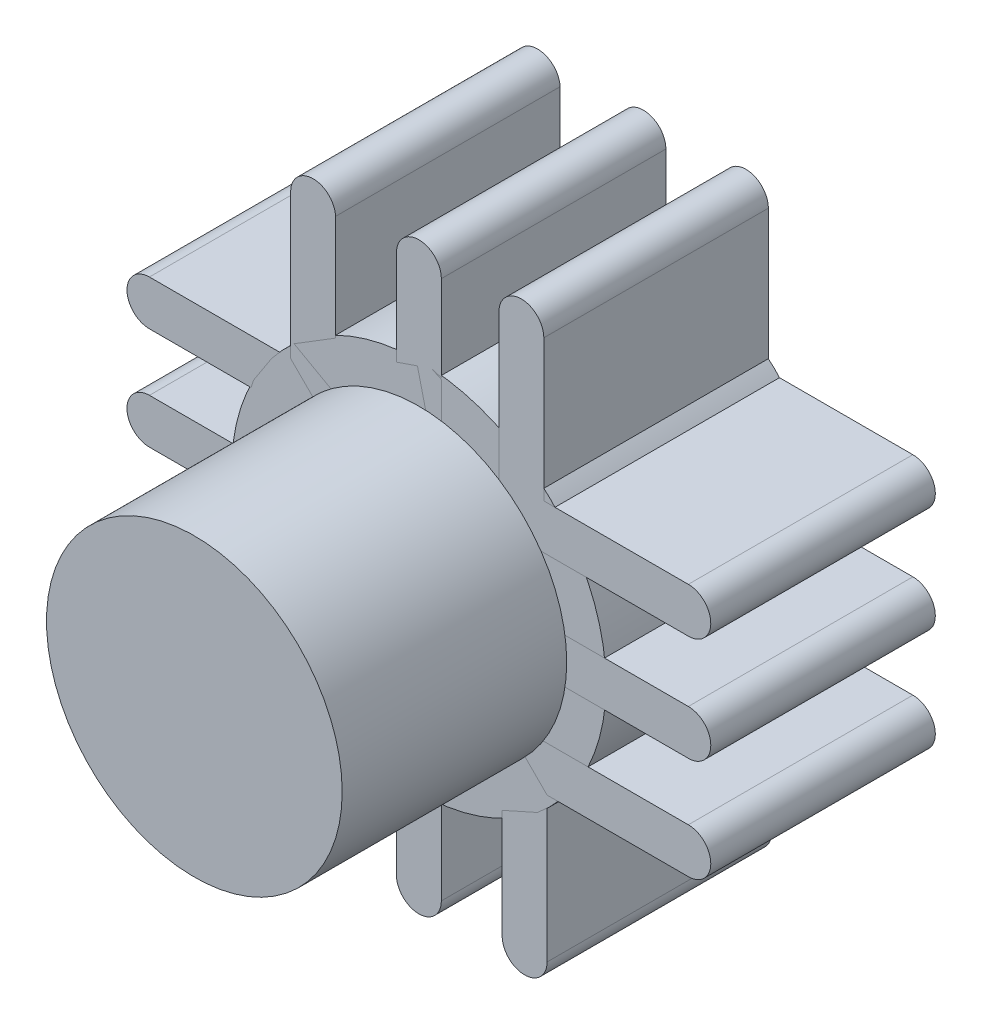
from build123d import *

# Parameters (mm, degrees)
BOSS_EXTRUDE1_DEPTH   = 10
BOSS_EXTRUDE1_2_DEPTH = 10
BOSS_EXTRUDE1_3_DEPTH = 10
BOSS_EXTRUDE1_4_DEPTH = 10
BOSS_EXTRUDE1_5_DEPTH = 10
BOSS_EXTRUDE1_6_DEPTH = 10
BOSS_EXTRUDE1_7_DEPTH = 10
BOSS_EXTRUDE1_8_DEPTH = 10
SKETCH2_R             = 8.334375
BOSS_EXTRUDE2_DEPTH   = 10
SKETCH3_R             = 6.584375
BOSS_EXTRUDE3_DEPTH   = 20


with BuildPart() as part:
    # Sketch1 → Boss-Extrude1 (new body)
    with BuildSketch(Plane.XY):
        with BuildLine():
            Line((-1, 3.665680024), (-1, 12))
            ThreePointArc((-1, 12), (0, 13), (1, 12))
            Line((1, 12), (1, 3.665680024))
            ThreePointArc((1, 3.665680024), (0, 2.665680024), (-1, 3.665680024))
        make_face()
    extrude(amount=BOSS_EXTRUDE1_DEPTH)


with BuildPart() as body_2:
    # Sketch1 → Boss-Extrude1 2 (new body)
    with BuildSketch(Plane.XY):
        with BuildLine():
            Line((5.5637058, 11.999998584), (5.5637058, 5.710489197))
            Line((5.5637058, 5.710489197), (11.999393728, 5.710489197))
            ThreePointArc((11.999393728, 5.710489197), (12.999696818, 4.734512976), (12.048638904, 3.710489197))
            Line((12.048638904, 3.710489197), (3.563457884, 3.710489197))
            Line((3.563457884, 3.710489197), (3.563457884, 11.999876038))
            ThreePointArc((3.563457884, 11.999876038), (4.563520572, 12.999999998), (5.5637058, 11.999998584))
        make_face()
    extrude(amount=BOSS_EXTRUDE1_2_DEPTH)


with BuildPart() as body_3:
    # Sketch1 → Boss-Extrude1 3 (new body)
    with BuildSketch(Plane.XY):
        with BuildLine():
            Line((11.999998584, -5.5637058), (5.710489197, -5.5637058))
            Line((5.710489197, -5.5637058), (5.710489197, -11.999393728))
            ThreePointArc((5.710489197, -11.999393728), (4.734512976, -12.999696818), (3.710489197, -12.048638904))
            Line((3.710489197, -12.048638904), (3.710489197, -3.563457884))
            Line((3.710489197, -3.563457884), (11.999876038, -3.563457884))
            ThreePointArc((11.999876038, -3.563457884), (12.999999998, -4.563520572), (11.999998584, -5.5637058))
        make_face()
    extrude(amount=BOSS_EXTRUDE1_3_DEPTH)


with BuildPart() as body_4:
    # Sketch1 → Boss-Extrude1 4 (new body)
    with BuildSketch(Plane.XY):
        with BuildLine():
            Line((3.665680024, 1), (12, 1))
            ThreePointArc((12, 1), (13, 0), (12, -1))
            Line((12, -1), (3.665680024, -1))
            ThreePointArc((3.665680024, -1), (2.665680024, 0), (3.665680024, 1))
        make_face()
    extrude(amount=BOSS_EXTRUDE1_4_DEPTH)


with BuildPart() as body_5:
    # Sketch1 → Boss-Extrude1 5 (new body)
    with BuildSketch(Plane.XY):
        with BuildLine():
            Line((-5.5637058, -11.999998584), (-5.5637058, -5.710489197))
            Line((-5.5637058, -5.710489197), (-11.999393728, -5.710489197))
            ThreePointArc((-11.999393728, -5.710489197), (-12.999696818, -4.734512976), (-12.048638904, -3.710489197))
            Line((-12.048638904, -3.710489197), (-3.563457884, -3.710489197))
            Line((-3.563457884, -3.710489197), (-3.563457884, -11.999876038))
            ThreePointArc((-3.563457884, -11.999876038), (-4.563520572, -12.999999998), (-5.5637058, -11.999998584))
        make_face()
    extrude(amount=BOSS_EXTRUDE1_5_DEPTH)


with BuildPart() as body_6:
    # Sketch1 → Boss-Extrude1 6 (new body)
    with BuildSketch(Plane.XY):
        with BuildLine():
            Line((1, -3.665680024), (1, -12))
            ThreePointArc((1, -12), (0, -13), (-1, -12))
            Line((-1, -12), (-1, -3.665680024))
            ThreePointArc((-1, -3.665680024), (0, -2.665680024), (1, -3.665680024))
        make_face()
    extrude(amount=BOSS_EXTRUDE1_6_DEPTH)


with BuildPart() as body_7:
    # Sketch1 → Boss-Extrude1 7 (new body)
    with BuildSketch(Plane.XY):
        with BuildLine():
            Line((-3.665680024, -1), (-12, -1))
            ThreePointArc((-12, -1), (-13, 0), (-12, 1))
            Line((-12, 1), (-3.665680024, 1))
            ThreePointArc((-3.665680024, 1), (-2.665680024, 0), (-3.665680024, -1))
        make_face()
    extrude(amount=BOSS_EXTRUDE1_7_DEPTH)


with BuildPart() as body_8:
    # Sketch1 → Boss-Extrude1 8 (new body)
    with BuildSketch(Plane.XY):
        with BuildLine():
            Line((-11.999998584, 5.5637058), (-5.710489197, 5.5637058))
            Line((-5.710489197, 5.5637058), (-5.710489197, 11.999393728))
            ThreePointArc((-5.710489197, 11.999393728), (-4.734512976, 12.999696818), (-3.710489197, 12.048638904))
            Line((-3.710489197, 12.048638904), (-3.710489197, 3.563457884))
            Line((-3.710489197, 3.563457884), (-11.999876038, 3.563457884))
            ThreePointArc((-11.999876038, 3.563457884), (-12.999999998, 4.563520572), (-11.999998584, 5.5637058))
        make_face()
    extrude(amount=BOSS_EXTRUDE1_8_DEPTH)


with BuildPart() as body_9:
    # Sketch2 → Boss-Extrude2 (new body)
    with BuildSketch(Plane.XY):
        Circle(SKETCH2_R)
    extrude(amount=BOSS_EXTRUDE2_DEPTH)


with BuildPart() as body_10:
    # Sketch3 → Boss-Extrude3 (new body)
    with BuildSketch(Plane.XY):
        Circle(SKETCH3_R)
    extrude(amount=BOSS_EXTRUDE3_DEPTH)


solid = Compound([part.part, body_2.part, body_3.part, body_4.part, body_5.part, body_6.part, body_7.part, body_8.part, body_9.part, body_10.part])
